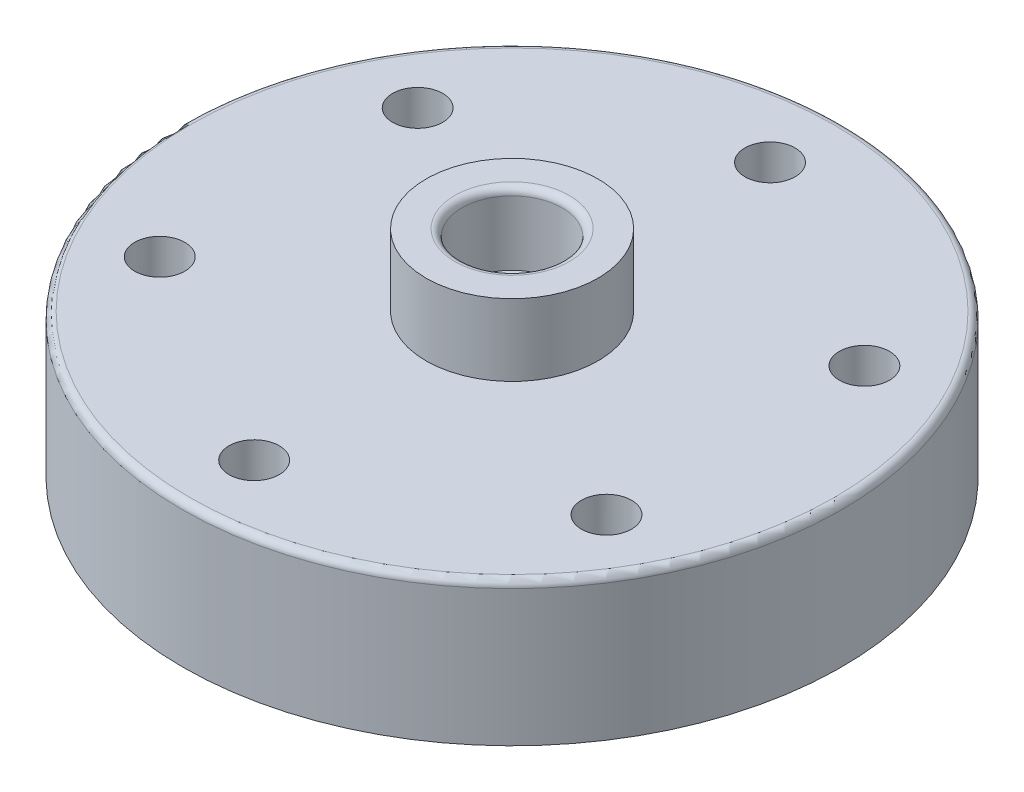
from build123d import *

# Parameters (mm, degrees)
SKETCH1_R           = 46
SKETCH1_R_2         = 3.5
BOSS_EXTRUDE1_DEPTH = 20
FILLET1_R           = 1
SKETCH2_R           = 12
BOSS_EXTRUDE2_DEPTH = 10
SKETCH3_R           = 33
CUT_EXTRUDE1_DEPTH  = 14
SKETCH4_R           = 2.5
CUT_EXTRUDE2_DEPTH  = 6
SKETCH5_R           = 7
CUT_EXTRUDE3_DEPTH  = 10
FILLET2_R           = 1
SKETCH6_R           = 4
CUT_EXTRUDE4_DEPTH  = 54


with BuildPart() as part:
    # Sketch1 → Boss-Extrude1 (new body)
    with BuildSketch(Plane(origin=(0, 0, 0), x_dir=(1, 0, 0), z_dir=(0, 1, 0))):
        with Locations(Location((0, 0, 0), (0, 0, 270))):
            Circle(SKETCH1_R)
        with Locations(Location((0, 36, 0), (0, 0, 270))):
            Circle(SKETCH1_R_2, mode=Mode.SUBTRACT)
        with Locations(Location((31.176914536, 18, 0), (0, 0, 270))):
            Circle(SKETCH1_R_2, mode=Mode.SUBTRACT)
        with Locations(Location((31.176914536, -18, 0), (0, 0, 270))):
            Circle(SKETCH1_R_2, mode=Mode.SUBTRACT)
        with Locations(Location((0, -36, 0), (0, 0, 270))):
            Circle(SKETCH1_R_2, mode=Mode.SUBTRACT)
        with Locations(Location((-31.176914536, -18, 0), (0, 0, 270))):
            Circle(SKETCH1_R_2, mode=Mode.SUBTRACT)
        with Locations(Location((-31.176914536, 18, 0), (0, 0, 270))):
            Circle(SKETCH1_R_2, mode=Mode.SUBTRACT)
    extrude(amount=BOSS_EXTRUDE1_DEPTH)

    # Fillet1
    fillet1_edges = [part.edges().sort_by_distance(p)[0] for p in [
        (0, 20, -46),
    ]]
    fillet(fillet1_edges, radius=FILLET1_R)

    # Sketch2 → Boss-Extrude2 (add)
    with BuildSketch(Plane(origin=(0, 20, 0), x_dir=(1, 0, 0), z_dir=(0, 1, 0))):
        with Locations(Location((0, 0, 0), (0, 0, 270))):
            Circle(SKETCH2_R)
    extrude(amount=BOSS_EXTRUDE2_DEPTH)

    # Sketch3 → Cut-Extrude1 (cut)
    with BuildSketch(Plane.XZ):
        Circle(SKETCH3_R)
    extrude(amount=-CUT_EXTRUDE1_DEPTH, mode=Mode.SUBTRACT)

    # Sketch4 → Cut-Extrude2 (cut)
    with BuildSketch(Plane.XZ.offset(-14)):
        with Locations(Location((0, 0, 0), (0, 0, 270))):
            Circle(SKETCH4_R)
    extrude(amount=-CUT_EXTRUDE2_DEPTH, mode=Mode.SUBTRACT)

    # Sketch5 → Cut-Extrude3 (cut)
    with BuildSketch(Plane(origin=(0, 30, 0), x_dir=(1, 0, 0), z_dir=(0, 1, 0))):
        with Locations(Location((0, 0, 0), (0, 0, 270))):
            Circle(SKETCH5_R)
    extrude(amount=-CUT_EXTRUDE3_DEPTH, mode=Mode.SUBTRACT)

    # Fillet2
    fillet2_edges = [part.edges().sort_by_distance(p)[0] for p in [
        (0, 30, -7),
    ]]
    fillet(fillet2_edges, radius=FILLET2_R)

    # Sketch6 → Cut-Extrude4 (cut)
    with BuildSketch(Plane(origin=(0, 0, 0), x_dir=(0, 0, -1), z_dir=(1, 0, 0))):
        with Locations((0, 8)):
            Circle(SKETCH6_R)
    extrude(amount=-CUT_EXTRUDE4_DEPTH, mode=Mode.SUBTRACT)


solid = part.part
